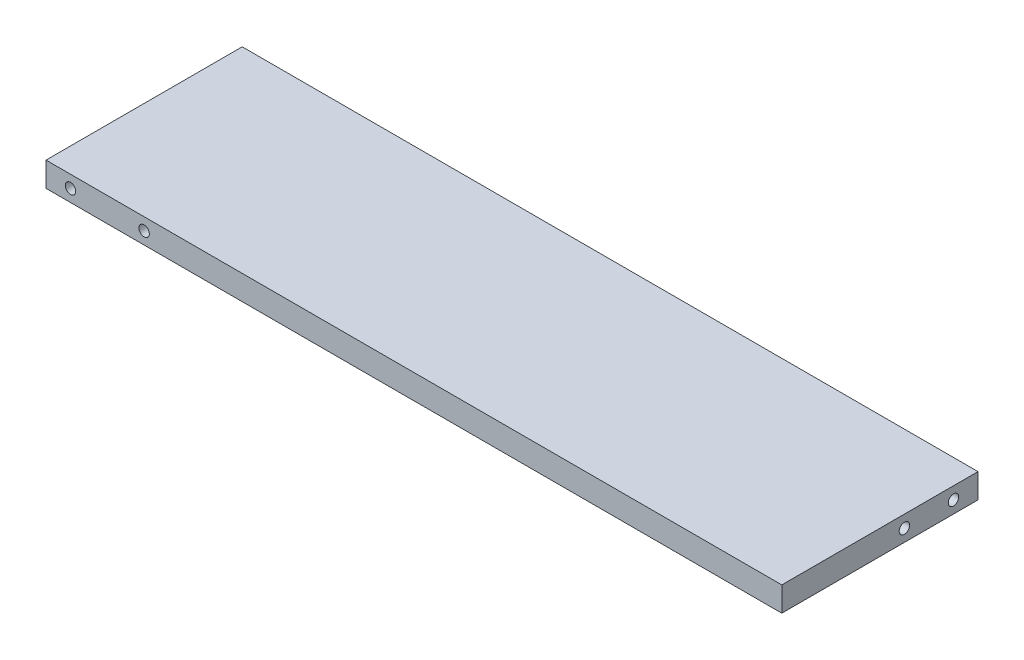
from build123d import *

# Parameters (mm, degrees)
SKETCH1_W                 = 190.5
SKETCH1_H                 = 50.8
BOSS_EXTRUDE1_DEPTH       = 3.175
F_6_32_TAPPED_HOLE1_D     = 2.7051
F_6_32_TAPPED_HOLE1_DEPTH = 12.7
F_6_32_TAPPED_HOLE1_TIP   = 0.81269403
F_6_32_TAPPED_HOLE2_D     = 2.7051
F_6_32_TAPPED_HOLE2_DEPTH = 14.224
F_6_32_TAPPED_HOLE2_TIP   = 0.81269403


with BuildPart() as part:
    # Sketch1 → Boss-Extrude1 (new, symmetric)
    with BuildSketch(Plane(origin=(0, 0, 0), x_dir=(1, 0, 0), z_dir=(0, 1, 0))):
        Rectangle(SKETCH1_W, SKETCH1_H)
    extrude(amount=BOSS_EXTRUDE1_DEPTH, both=True)

    # #6-32 Tapped Hole1
    with Locations(Plane.XY.offset(25.4)):
        with Locations((-69.85, 0), (-88.9, 0)):
            Hole(F_6_32_TAPPED_HOLE1_D / 2, depth=F_6_32_TAPPED_HOLE1_DEPTH)
            with Locations((0, 0, -(F_6_32_TAPPED_HOLE1_DEPTH + F_6_32_TAPPED_HOLE1_TIP / 2))):  # 118° drill point
                Cone(0, F_6_32_TAPPED_HOLE1_D / 2, F_6_32_TAPPED_HOLE1_TIP, mode=Mode.SUBTRACT)

    # #6-32 Tapped Hole2
    with Locations(Plane(origin=(95.25, 0, 0), x_dir=(0, 0, -1), z_dir=(1, 0, 0))):
        with Locations((6.35, 0), (19.05, 0)):
            Hole(F_6_32_TAPPED_HOLE2_D / 2, depth=F_6_32_TAPPED_HOLE2_DEPTH)
            with Locations((0, 0, -(F_6_32_TAPPED_HOLE2_DEPTH + F_6_32_TAPPED_HOLE2_TIP / 2))):  # 118° drill point
                Cone(0, F_6_32_TAPPED_HOLE2_D / 2, F_6_32_TAPPED_HOLE2_TIP, mode=Mode.SUBTRACT)


solid = part.part
